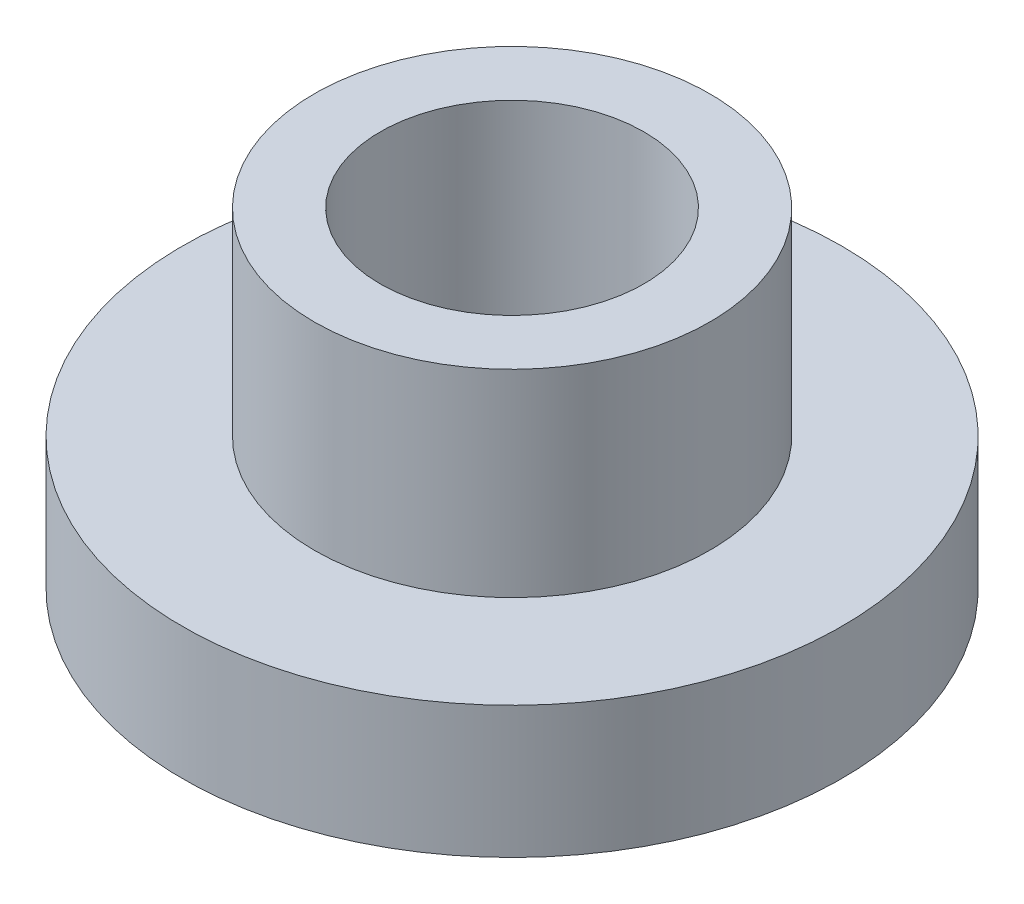
from build123d import *

# Parameters (mm, degrees)
SKETCH_1_R      = 1.5
SKETCH_1_R_2    = 1
EXTRUDE_1_DEPTH = 1.5
SKETCH_2_R      = 2.5
EXTRUDE_2_DEPTH = 1


with BuildPart() as part:
    # 草图1 → 凸台-拉伸1 (new body)
    with BuildSketch(Plane(origin=(0, 0, 0), x_dir=(1, 0, 0), z_dir=(0, 1, 0))):
        with Locations(Location((0, 0, 0), (0, 0, 270))):
            Circle(SKETCH_1_R)
        with Locations(Location((0, 0, 0), (0, 0, 270))):
            Circle(SKETCH_1_R_2, mode=Mode.SUBTRACT)
    extrude(amount=EXTRUDE_1_DEPTH)

    # 草图2 → 凸台-拉伸2 (add)
    with BuildSketch(Plane.XZ):
        with Locations(Location((0, 0, 0), (0, 0, 270))):
            Circle(SKETCH_2_R)
    extrude(amount=EXTRUDE_2_DEPTH)


solid = part.part
